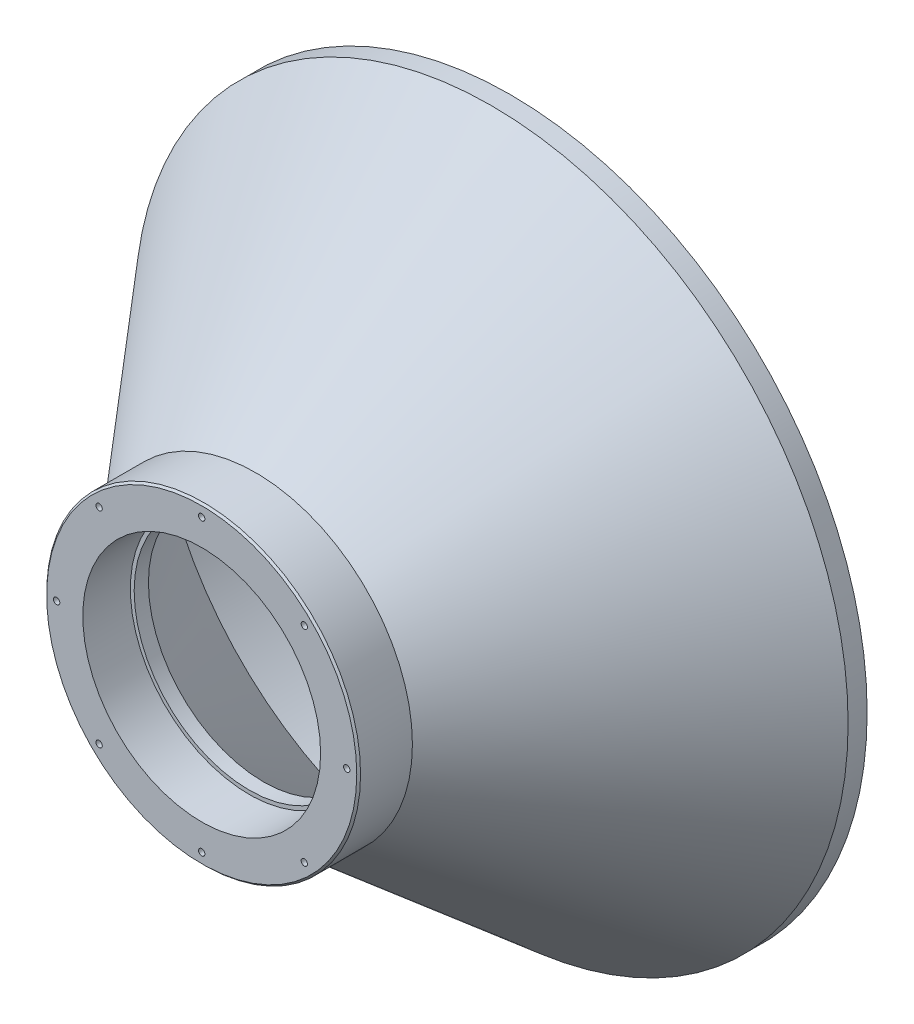
from build123d import *

# Parameters (mm, degrees)
HOLE1_D                      = 8
HOLE1_DEPTH                  = 10
F_5_16_CLEARANCE_HOLE1_D     = 8.376
F_5_16_CLEARANCE_HOLE1_DEPTH = 23
F_5_16_CLEARANCE_HOLE1_TIP   = 2.516404272
F_1_4_CLEARANCE_HOLE1_D      = 6.647
F_1_4_CLEARANCE_HOLE1_DEPTH  = 20
F_1_4_CLEARANCE_HOLE1_TIP    = 1.996960267
CHAMFER1_SIZE                = 0.5
CHAMFER6_SIZE                = 2
CHAMFER7_SIZE                = 2


with BuildPart() as part:
    # Sketch1 → Revolve1 (revolve)
    with BuildSketch(Plane(origin=(0, 0, 0), x_dir=(1, 0, 0), z_dir=(0, 1, 0))):
        Polygon((375, 4.500036707), (0, 4.500036707), (0, -320), (165, -320), (165, -263.511012034), (375, -15.499963293), align=None)
    revolve(axis=Axis((0, 0, -4.500036707), (0, 0, 1)))

    # Sketch2 → Cut-Revolve1 (revolve, cut)
    with BuildSketch(Plane(origin=(0, 0, 0), x_dir=(1, 0, 0), z_dir=(0, 1, 0))):
        Polygon((315, 4.500036707), (0, 4.500036707), (0, -320), (125, -320), (125, -270), (121, -270), (121, -255), (146, -255), (315, -55.410156014), align=None)
    revolve(axis=Axis((0, 0, -4.500036707), (0, 0, 1)), mode=Mode.SUBTRACT)

    # Hole1
    with Locations(Plane(origin=(0, 0, -4.500036707), x_dir=(-1, 0, 0), z_dir=(0, 0, -1))):
        with Locations((314.119041054, -130.112367004), (-314.119041054, 130.112367004)):
            Hole(HOLE1_D / 2, depth=HOLE1_DEPTH)

    # 5/16 Clearance Hole1
    with Locations(Plane(origin=(0, 0, -4.500036707), x_dir=(-1, 0, 0), z_dir=(0, 0, -1))):
        with Locations((0, -345), (-172.5, -298.778764306), (-298.778764306, -172.5), (-345, 0), (-298.778764306, 172.5), (-172.5, 298.778764306), (0, 345), (172.5, 298.778764306), (298.778764306, 172.5), (345, 0), (298.778764306, -172.5), (172.5, -298.778764306)):
            Hole(F_5_16_CLEARANCE_HOLE1_D / 2, depth=F_5_16_CLEARANCE_HOLE1_DEPTH)
            with Locations((0, 0, -(F_5_16_CLEARANCE_HOLE1_DEPTH + F_5_16_CLEARANCE_HOLE1_TIP / 2))):  # 118° drill point
                Cone(0, F_5_16_CLEARANCE_HOLE1_D / 2, F_5_16_CLEARANCE_HOLE1_TIP, mode=Mode.SUBTRACT)

    # 1/4 Clearance Hole1
    with Locations(Plane.XY.offset(320)):
        with Locations((-107.833784131, 107.833784131), (0, 152.5), (107.833784131, 107.833784131), (152.5, 0), (107.833784131, -107.833784131), (0, -152.5), (-107.833784131, -107.833784131), (-152.5, 0)):
            Hole(F_1_4_CLEARANCE_HOLE1_D / 2, depth=F_1_4_CLEARANCE_HOLE1_DEPTH)
            with Locations((0, 0, -(F_1_4_CLEARANCE_HOLE1_DEPTH + F_1_4_CLEARANCE_HOLE1_TIP / 2))):  # 118° drill point
                Cone(0, F_1_4_CLEARANCE_HOLE1_D / 2, F_1_4_CLEARANCE_HOLE1_TIP, mode=Mode.SUBTRACT)

    # Chamfer1
    chamfer1_edges = [part.edges().sort_by_distance(p)[0] for p in [
        (310.119041054, 130.112367004, -4.500036707),
        (-318.119041054, -130.112367004, -4.500036707),
        (-176.688, 298.778764306, -4.500036707),
        (-4.188, 345, -4.500036707),
        (168.312, 298.778764306, -4.500036707),
        (294.590764306, 172.5, -4.500036707),
        (340.812, 0, -4.500036707),
        (294.590764306, -172.5, -4.500036707),
        (168.312, -298.778764306, -4.500036707),
        (-4.188, -345, -4.500036707),
    ]]
    chamfer(chamfer1_edges, length=CHAMFER1_SIZE)

    # Chamfer6
    chamfer6_edges = [part.edges().sort_by_distance(p)[0] for p in [
        (-315, 0, -4.500036707),
    ]]
    chamfer(chamfer6_edges, length=CHAMFER6_SIZE)

    # Chamfer7
    chamfer7_edges = [part.edges().sort_by_distance(p)[0] for p in [
        (-165, 0, 320),
    ]]
    chamfer(chamfer7_edges, length=CHAMFER7_SIZE)


solid = part.part
